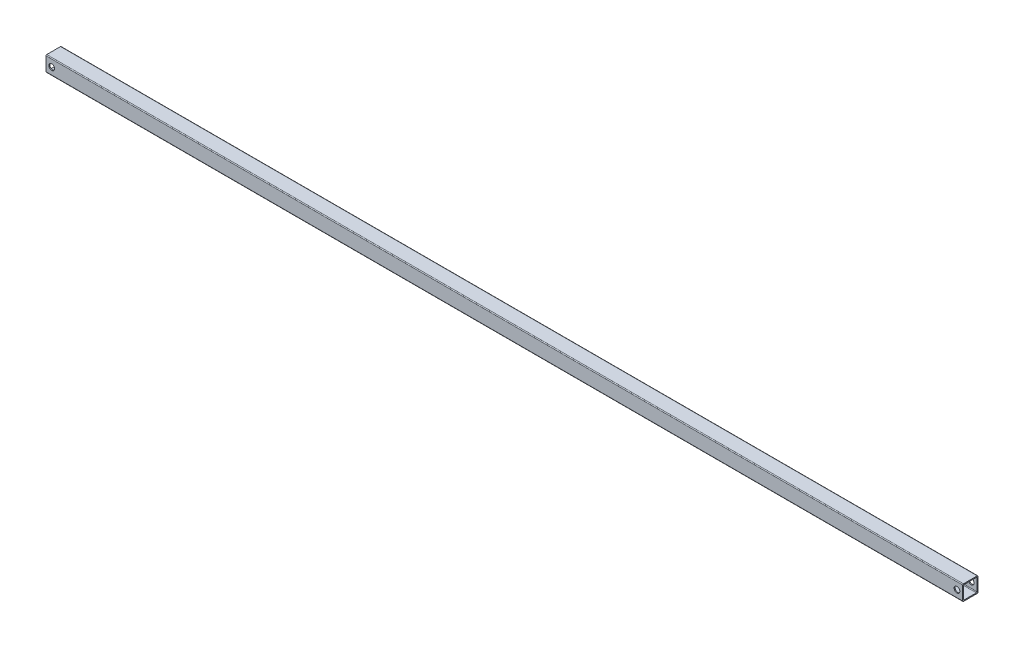
from build123d import *

# Parameters (mm, degrees)
BOSS_EXTRUDE1_DEPTH      = 762
BOSS_EXTRUDE1_DEPTH_BACK = 762
SKETCH6_R                = 4.7625
CUT_EXTRUDE1_DEPTH       = 763.528983056


with BuildPart() as part:
    # Sketch4 → Boss-Extrude1 (new, two sides: drawn at the far end of the back side and taken through both)
    with BuildSketch(Plane(origin=(0, 0, 0), x_dir=(0, 0, -1), z_dir=(1, 0, 0)).offset(-BOSS_EXTRUDE1_DEPTH_BACK)):
        with BuildLine():
            Line((12.7, -11.43), (12.7, 11.43))
            ThreePointArc((12.7, 11.43), (12.328025612, 12.328025612), (11.43, 12.7))
            Line((11.43, 12.7), (-11.43, 12.7))
            ThreePointArc((-11.43, 12.7), (-12.328025612, 12.328025612), (-12.7, 11.43))
            Line((-12.7, 11.43), (-12.7, -11.43))
            ThreePointArc((-12.7, -11.43), (-12.328025612, -12.328025612), (-11.43, -12.7))
            Line((-11.43, -12.7), (11.43, -12.7))
            ThreePointArc((11.43, -12.7), (12.328025612, -12.328025612), (12.7, -11.43))
        make_face()
        with BuildLine():
            Line((11.049, 9.9441), (11.049, -9.9441))
            ThreePointArc((11.049, -9.9441), (10.725382283, -10.725382283), (9.9441, -11.049))
            Line((9.9441, -11.049), (-9.9441, -11.049))
            ThreePointArc((-9.9441, -11.049), (-10.725382283, -10.725382283), (-11.049, -9.9441))
            Line((-11.049, -9.9441), (-11.049, 9.9441))
            ThreePointArc((-11.049, 9.9441), (-10.725382283, 10.725382283), (-9.9441, 11.049))
            Line((-9.9441, 11.049), (9.9441, 11.049))
            ThreePointArc((9.9441, 11.049), (10.725382283, 10.725382283), (11.049, 9.9441))
        make_face(mode=Mode.SUBTRACT)
    extrude(amount=BOSS_EXTRUDE1_DEPTH + BOSS_EXTRUDE1_DEPTH_BACK)

    # Sketch6 → Cut-Extrude1 (cut, through all)
    with BuildSketch(Plane.XY.offset(12.7)):
        with Locations((752.475, 0)):
            Circle(SKETCH6_R)
        with Locations((-752.475, 0)):
            Circle(SKETCH6_R)
    extrude(amount=-CUT_EXTRUDE1_DEPTH, mode=Mode.SUBTRACT)


solid = part.part
